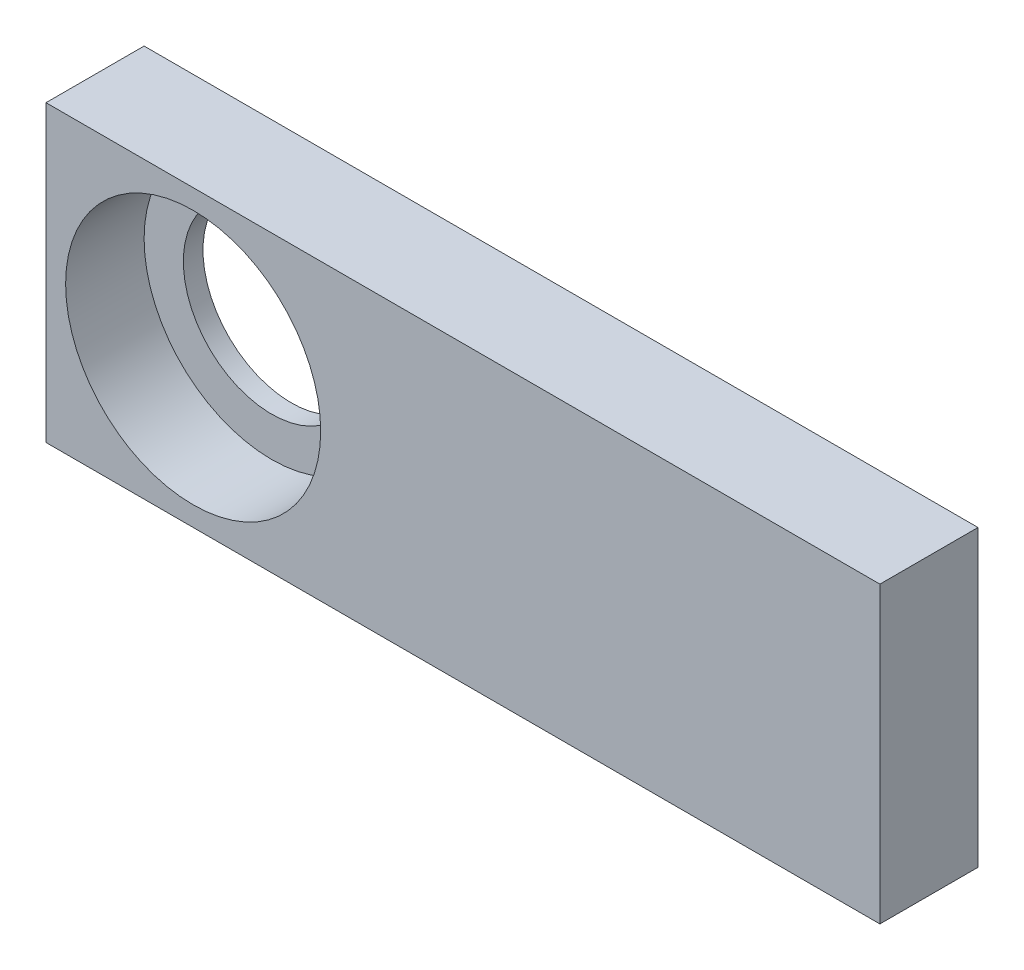
from build123d import *

# Parameters (mm, degrees)
ESBO_O1_W                = 150
ESBO_O1_H                = 30
RESSALTO_EXTRUS_O1_DEPTH = 10
ESBO_O2_R                = 13
CORTE_EXTRUS_O1_DEPTH    = 8
CORTE_EXTRUS_O2_REACH    = 78.903
ESBO_O3_R                = 9
CORTE_EXTRUS_O3_REACH    = 83.394
ESBO_O4_W                = 65
ESBO_O4_H                = 10


with BuildPart() as part:
    # Esboço1 → Ressalto-extrusão1 (new body)
    with BuildSketch(Plane.XY):
        Rectangle(ESBO_O1_W, ESBO_O1_H)
    extrude(amount=RESSALTO_EXTRUS_O1_DEPTH)

    # Esboço2 → Corte-extrusão1 (cut)
    with BuildSketch(Plane.XY.offset(10)):
        with Locations((-60, 0)):
            Circle(ESBO_O2_R)
    extrude(amount=-CORTE_EXTRUS_O1_DEPTH, mode=Mode.SUBTRACT)

    # Esboço3 → Corte-extrusão2 (cut, up to next)
    with BuildSketch(Plane.XY.offset(2), mode=Mode.PRIVATE) as corte_extrus_o2_sk1:
        with Locations((-60, 0)):
            Circle(ESBO_O3_R)
    corte_extrus_o2_tool1 = extrude(corte_extrus_o2_sk1.sketch, amount=-CORTE_EXTRUS_O2_REACH, mode=Mode.PRIVATE) & part.part
    add(corte_extrus_o2_tool1.solids().sort_by_distance((-60, 0, 2))[0], mode=Mode.SUBTRACT)

    # Esboço4 → Corte-extrusão3 (cut, up to next)
    with BuildSketch(Plane.XZ.offset(15), mode=Mode.PRIVATE) as corte_extrus_o3_sk1:
        with Locations((42.5, 5)):
            Rectangle(ESBO_O4_W, ESBO_O4_H)
    corte_extrus_o3_tool1 = extrude(corte_extrus_o3_sk1.sketch, amount=-CORTE_EXTRUS_O3_REACH, mode=Mode.PRIVATE) & part.part
    add(corte_extrus_o3_tool1.solids().sort_by_distance((42.5, -15, 5))[0], mode=Mode.SUBTRACT)


solid = part.part
